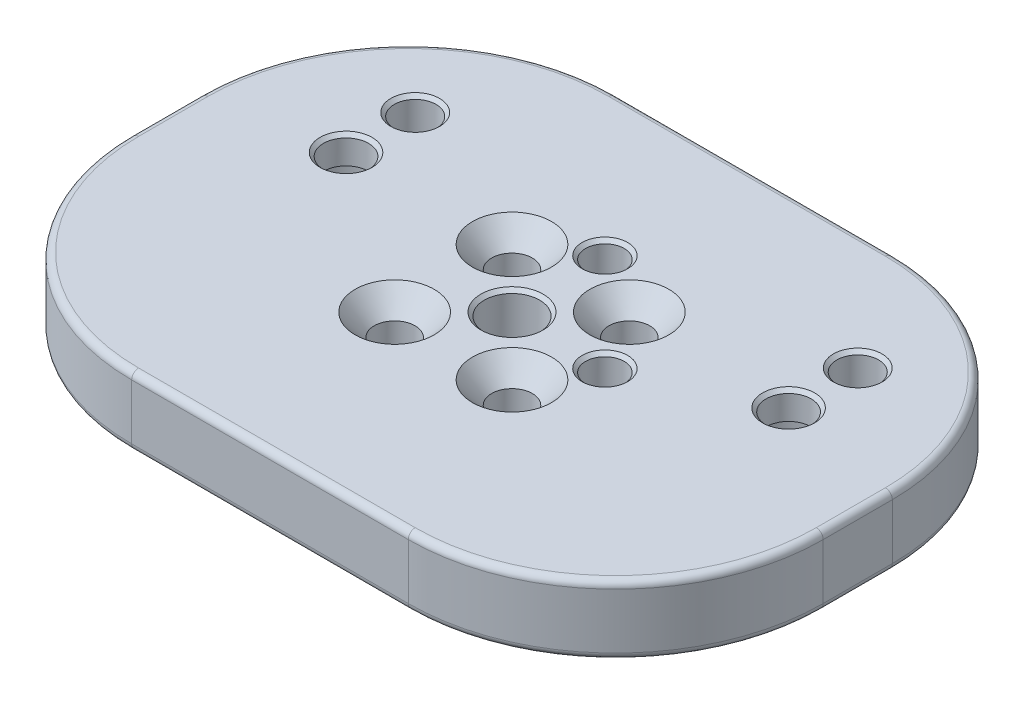
from build123d import *

# Parameters (mm, degrees)
SKETCH1_W                                      = 50
SKETCH1_H                                      = 35
BOSS_EXTRUDE2_DEPTH                            = 5
SKETCH2_R                                      = 2
CUT_EXTRUDE1_DEPTH                             = 31.923292192
SKETCH3_R                                      = 9
CUT_EXTRUDE2_DEPTH                             = 1.5
SKETCH6_R                                      = 1.5113
CUT_EXTRUDE5_DEPTH                             = 4.8
SKETCH7_R                                      = 1.63195
CUT_EXTRUDE6_DEPTH                             = 31.923292192
SKETCH8_R                                      = 1.95
BOSS_EXTRUDE3_DEPTH                            = 2
FILLET1_R                                      = 15
SKETCH10_R                                     = 2.8575
CUT_EXTRUDE9_DEPTH                             = 3
CSK_FOR_4_FLAT_HEAD_MACHINE_SCREW1_D           = 2.9464
CSK_FOR_4_FLAT_HEAD_MACHINE_SCREW1_CSINK_D     = 5.715
CSK_FOR_4_FLAT_HEAD_MACHINE_SCREW1_CSINK_ANGLE = 82
SKETCH23_R                                     = 1.397
CUT_EXTRUDE13_DEPTH                            = 32.008063467
SKETCH24_R                                     = 2.794
CUT_EXTRUDE14_DEPTH                            = 2.75
CHAMFER1_SIZE                                  = 0.25
FILLET2_R                                      = 0.5
CHAMFER2_SIZE                                  = 0.25


with BuildPart() as part:
    # Sketch1 → Boss-Extrude2 (new body)
    with BuildSketch(Plane(origin=(0, 0, 0), x_dir=(1, 0, 0), z_dir=(0, 1, 0))):
        Rectangle(SKETCH1_W, SKETCH1_H)
    extrude(amount=-BOSS_EXTRUDE2_DEPTH)

    # Sketch2 → Cut-Extrude1 (cut, through all)
    with BuildSketch(Plane(origin=(0, 0, 0), x_dir=(1, 0, 0), z_dir=(0, 1, 0))):
        with Locations(Location((0, 0, 0), (0, 0, 270))):
            Circle(SKETCH2_R)
    extrude(amount=-CUT_EXTRUDE1_DEPTH, mode=Mode.SUBTRACT)

    # Sketch3 → Cut-Extrude2 (cut)
    with BuildSketch(Plane.XZ.offset(5)):
        with Locations(Location((0, 0, 0), (0, 0, 270))):
            Circle(SKETCH3_R)
    extrude(amount=-CUT_EXTRUDE2_DEPTH, mode=Mode.SUBTRACT)

    # Sketch6 → Cut-Extrude5 (cut)
    with BuildSketch(Plane(origin=(0, 0, 0), x_dir=(1, 0, 0), z_dir=(0, 1, 0))):
        with Locations(Location((-16, 9, 0), (0, 0, 270))):
            Circle(SKETCH6_R)
        with Locations(Location((16, 9, 0), (0, 0, 270))):
            Circle(SKETCH6_R)
    extrude(amount=-CUT_EXTRUDE5_DEPTH, mode=Mode.SUBTRACT)

    # Sketch7 → Cut-Extrude6 (cut, through all)
    with BuildSketch(Plane(origin=(0, 0, 0), x_dir=(1, 0, 0), z_dir=(0, 1, 0))):
        with Locations(Location((-16, 4, 0), (0, 0, 270))):
            Circle(SKETCH7_R)
        with Locations(Location((16, 4, 0), (0, 0, 270))):
            Circle(SKETCH7_R)
    extrude(amount=-CUT_EXTRUDE6_DEPTH, mode=Mode.SUBTRACT)

    # Sketch8 → Boss-Extrude3 (add)
    with BuildSketch(Plane.XZ.offset(3.5)):
        with Locations(Location((-6, 0, 0), (0, 0, 270))):
            Circle(SKETCH8_R)
    extrude(amount=BOSS_EXTRUDE3_DEPTH)

    # Fillet1
    fillet1_edges = [part.edges().sort_by_distance(p)[0] for p in [
        (25, -2.5, 17.5),
        (-25, -2.5, 17.5),
        (-25, -2.5, -17.5),
        (25, -2.5, -17.5),
    ]]
    fillet(fillet1_edges, radius=FILLET1_R)

    # Sketch10 → Cut-Extrude9 (cut)
    with BuildSketch(Plane.XZ.offset(5)):
        with Locations(Location((-16, -4, 0), (0, 0, 270))):
            Circle(SKETCH10_R)
        with Locations(Location((16, -4, 0), (0, 0, 270))):
            Circle(SKETCH10_R)
    extrude(amount=-CUT_EXTRUDE9_DEPTH, mode=Mode.SUBTRACT)

    # CSK for #4 Flat Head Machine Screw1 (through all)
    with Locations(Plane(origin=(4.242640687, 0, -4.242640687), x_dir=(0, 0, 1), z_dir=(0, 1, 0))):
        with Locations((0, 0), (8.485281374, 0), (8.485281374, -8.485281374), (0, -8.485281374)):
            CounterSinkHole(CSK_FOR_4_FLAT_HEAD_MACHINE_SCREW1_D / 2, CSK_FOR_4_FLAT_HEAD_MACHINE_SCREW1_CSINK_D / 2, counter_sink_angle=CSK_FOR_4_FLAT_HEAD_MACHINE_SCREW1_CSINK_ANGLE)

    # Sketch23 → Cut-Extrude13 (cut, through all)
    with BuildSketch(Plane(origin=(0, 0, 0), x_dir=(1, 0, 0), z_dir=(0, 1, 0))):
        with Locations(Location((-0.176776695, 6.894291117, 0), (0, 0, 270))):
            Circle(SKETCH23_R)
        with Locations(Location((6.894291117, -0.176776695, 0), (0, 0, 270))):
            Circle(SKETCH23_R)
    extrude(amount=-CUT_EXTRUDE13_DEPTH, mode=Mode.SUBTRACT)

    # Sketch24 → Cut-Extrude14 (cut)
    with BuildSketch(Plane.XZ.offset(5)):
        with Locations(Location((6.894291117, 0.176776695, 0), (0, 0, 270))):
            Circle(SKETCH24_R)
        with Locations(Location((-0.176776695, -6.894291117, 0), (0, 0, 270))):
            Circle(SKETCH24_R)
    extrude(amount=-CUT_EXTRUDE14_DEPTH, mode=Mode.SUBTRACT)

    # Chamfer1
    chamfer1_edges = [part.edges().sort_by_distance(p)[0] for p in [
        (-6, -5.5, 1.95),
    ]]
    chamfer(chamfer1_edges, length=CHAMFER1_SIZE)

    # Fillet2
    fillet2_edges = [part.edges().sort_by_distance(p)[0] for p in [
        (0, 0, -17.5),
        (0, -5, -17.5),
        (25, 0, 0),
        (-25, 0, 0),
        (0, 0, 17.5),
        (-20.606601718, 0, 13.106601718),
        (20.606601718, 0, 13.106601718),
        (20.606601718, 0, -13.106601718),
        (-20.606601718, 0, -13.106601718),
        (-25, -5, 0),
        (25, -5, 0),
        (0, -5, 17.5),
        (-20.606601718, -5, 13.106601718),
        (20.606601718, -5, 13.106601718),
        (20.606601718, -5, -13.106601718),
        (-20.606601718, -5, -13.106601718),
    ]]
    fillet(fillet2_edges, radius=FILLET2_R)

    # Chamfer2
    chamfer2_edges = [part.edges().sort_by_distance(p)[0] for p in [
        (-0.176776695, 0, -8.291291117),
        (6.894291117, 0, -1.220223305),
        (0, 0, -2),
        (-16, 0, -10.5113),
        (16, 0, -10.5113),
        (-16, 0, -5.63195),
        (16, 0, -5.63195),
    ]]
    chamfer(chamfer2_edges, length=CHAMFER2_SIZE)


solid = part.part
